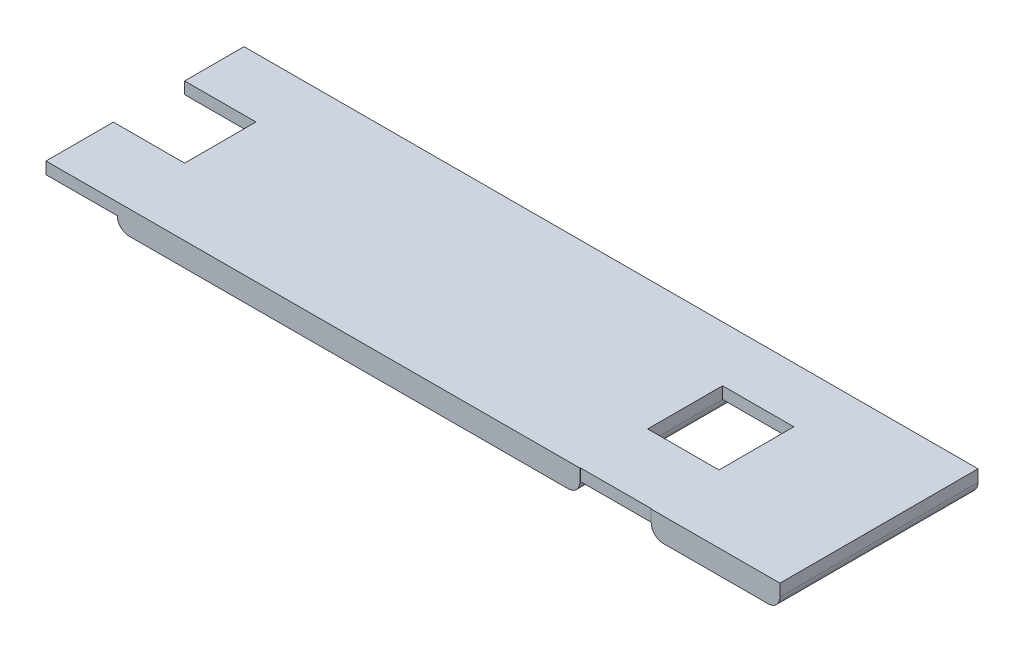
from build123d import *

# Parameters (mm, degrees)
BOSS_EXTRUDE4_DEPTH   = 50
BOSS_EXTRUDE4_2_DEPTH = 50
SKETCH7_W             = 17
SKETCH7_H             = 3
SKETCH7_W_2           = 14
BOSS_EXTRUDE5_DEPTH   = 18
SKETCH8_W             = 17
SKETCH8_H             = 3
SKETCH8_W_2           = 15
BOSS_EXTRUDE6_DEPTH   = 18


with BuildPart() as part:
    # Sketch6 → Boss-Extrude4 (new body)
    with BuildSketch(Plane.XY.offset(-2000)):
        with BuildLine():
            Line((24.966787002, 344.25912611), (24.966787002, 347.264784988))
            Line((24.966787002, 347.264784988), (-7.533155287, 347.203538294))
            Line((-7.533155287, 347.203538294), (-7.527501746, 344.203543621))
            ThreePointArc((-7.527501746, 344.203543621), (-6.644825993, 342.083882928), (-4.521853532, 341.209202489))
            Line((-4.521853532, 341.209202489), (21.972440543, 341.259131437))
            ThreePointArc((21.972440543, 341.259131437), (24.090105234, 342.139805537), (24.966787002, 344.25912611))
        make_face()
    extrude(amount=BOSS_EXTRUDE4_DEPTH)



with BuildPart() as body_2:
    # Sketch6 → Boss-Extrude4 2 (new body)
    with BuildSketch(Plane.XY.offset(-2000)):
        with BuildLine():
            Line((-25.527469784, 344.169622375), (-25.533123325, 347.169617048))
            Line((-25.533123325, 347.169617048), (-142.327839016, 346.949515419))
            Line((-142.327839016, 346.949515419), (-142.322185475, 343.949520746))
            ThreePointArc((-142.322185475, 343.949520746), (-141.439509722, 341.829860053), (-139.316537261, 340.955179614))
            Line((-139.316537261, 340.955179614), (-28.521810916, 341.163974161))
            ThreePointArc((-28.521810916, 341.163974161), (-26.402150223, 342.046649914), (-25.527469784, 344.169622375))
        make_face()
    extrude(amount=BOSS_EXTRUDE4_2_DEPTH)


with BuildPart() as part_1:
    add(part.part)

    add(body_2.part)  # Boss-Extrude5 merges body 2
    # Sketch7 → Boss-Extrude5 (add)
    with BuildSketch(Plane(origin=(-6.878819882, -0.012963253, 0), x_dir=(0, 0, 1), z_dir=(-0.9999982243025385, -0.001884513669318331, 0))):
        with Locations((-1958.612984199, 345.717118099)):
            Rectangle(SKETCH7_W, SKETCH7_H)
        with Locations((-1993, 345.717118099)):
            Rectangle(SKETCH7_W_2, SKETCH7_H)
    extrude(amount=BOSS_EXTRUDE5_DEPTH)

    # Sketch8 → Boss-Extrude6 (add)
    with BuildSketch(Plane(origin=(-141.673503611, -0.266986128, 0), x_dir=(0, 0, 1), z_dir=(-0.9999982243025385, -0.001884513669318331, 0))):
        with Locations((-1958.5, 345.717118099)):
            Rectangle(SKETCH8_W, SKETCH8_H)
        with Locations((-1992.5, 345.717118099)):
            Rectangle(SKETCH8_W_2, SKETCH8_H)
    extrude(amount=BOSS_EXTRUDE6_DEPTH)


solid = part_1.part
